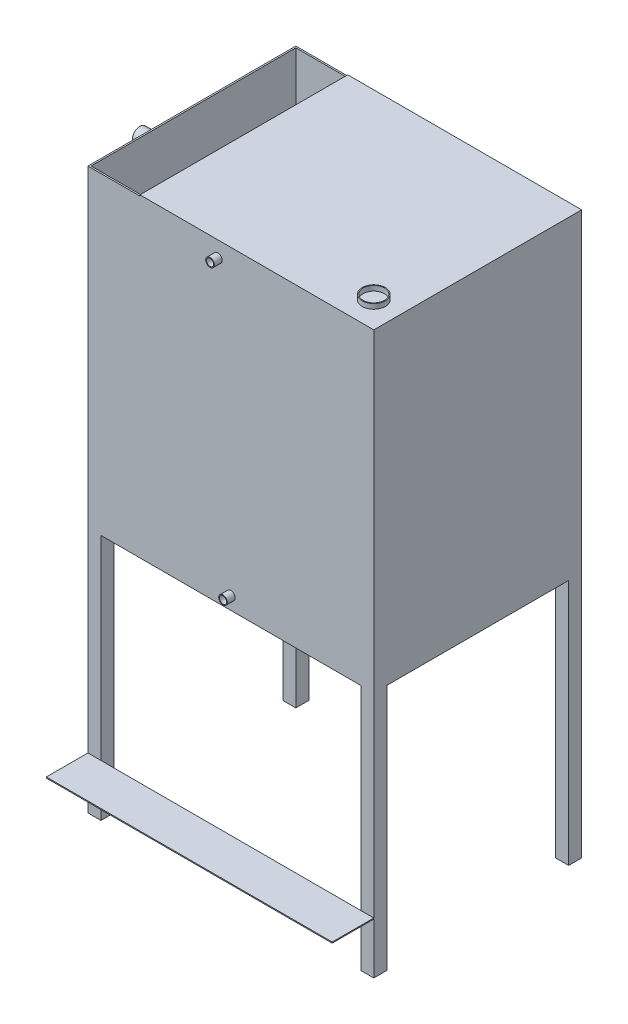
from build123d import *

# Parameters (mm, degrees)
SKETCH_1_W           = 1100
SKETCH_1_H           = 800
EXTRUDE_1_DEPTH      = 6
SKETCH_3_W           = 1100
SKETCH_3_H           = 800
SKETCH_3_W_2         = 1088
SKETCH_3_H_2         = 788
EXTRUDE_2_DEPTH      = 1200
SKETCH_4_W           = 900
SKETCH_4_H           = 800
EXTRUDE_3_DEPTH      = 4
SKETCH_5_W           = 50
SKETCH_5_H           = 50
EXTRUDE_4_DEPTH      = 950
EXTRUDE_5_DEPTH      = 19
EXTRUDE_5_DEPTH_BACK = 800
SKETCH_6_R           = 44.5
SKETCH_6_R_2         = 41
SKETCH_7_R           = 28.5
SKETCH_7_R_2         = 25
EXTRUDE_6_DEPTH      = 50
EXTRUDE_7_DEPTH      = 50
EXTRUDE_7_DEPTH_BACK = 50
SKETCH_8_R           = 16.75
SKETCH_8_R_2         = 13.55
SKETCH_9_R           = 21.15
SKETCH_9_R_2         = 17.95
EXTRUDE_8_DEPTH      = 49
SKETCH_10_R          = 16.75
SKETCH_10_R_2        = 13.55
EXTRUDE_9_DEPTH      = 30
SKETCH_13_W          = 1100
SKETCH_13_H          = 4
EXTRUDE_12_DEPTH     = 160
SKETCH_14_R          = 16.75
SKETCH_14_R_2        = 13.55
EXTRUDE_13_DEPTH     = 30


with BuildPart() as part:
    # Эскиз1 → Бобышка-Вытянуть1 (new body)
    with BuildSketch(Plane(origin=(0, 0, 0), x_dir=(1, 0, 0), z_dir=(0, 1, 0))):
        with Locations((550, 400)):
            Rectangle(SKETCH_1_W, SKETCH_1_H)
    extrude(amount=EXTRUDE_1_DEPTH)

    # Эскиз3 → Бобышка-Вытянуть2 (add)
    with BuildSketch(Plane(origin=(0, 6, 0), x_dir=(1, 0, 0), z_dir=(0, 1, 0))):
        with Locations((550, 400)):
            Rectangle(SKETCH_3_W, SKETCH_3_H)
        with Locations((550, 400)):
            Rectangle(SKETCH_3_W_2, SKETCH_3_H_2, mode=Mode.SUBTRACT)
    extrude(amount=EXTRUDE_2_DEPTH)

    # Эскиз4 → Бобышка-Вытянуть3 (add)
    with BuildSketch(Plane(origin=(0, 1206, 0), x_dir=(1, 0, 0), z_dir=(0, 1, 0))):
        with Locations((650, 400)):
            Rectangle(SKETCH_4_W, SKETCH_4_H)
    extrude(amount=EXTRUDE_3_DEPTH)

    # Эскиз5 → Бобышка-Вытянуть4 (add)
    with BuildSketch(Plane.XZ):
        with Locations((1075, -25)):
            Rectangle(SKETCH_5_W, SKETCH_5_H)
        with Locations((25, -25)):
            Rectangle(SKETCH_5_W, SKETCH_5_H)
        with Locations((1075, -775)):
            Rectangle(SKETCH_5_W, SKETCH_5_H)
        with Locations((25, -775)):
            Rectangle(SKETCH_5_W, SKETCH_5_H)
    extrude(amount=EXTRUDE_4_DEPTH)

    # Эскиз6 → Бобышка-Вытянуть5 (add, two sides: drawn at the far end of the back side and taken through both)
    with BuildSketch(Plane(origin=(0, 1210, 0), x_dir=(1, 0, 0), z_dir=(0, 1, 0)).offset(-EXTRUDE_5_DEPTH_BACK)):
        with Locations(Location((1000, 100, 0), (0, 0, 270))):
            Circle(SKETCH_6_R)
        with Locations(Location((1000, 100, 0), (0, 0, 270))):
            Circle(SKETCH_6_R_2, mode=Mode.SUBTRACT)
    extrude(amount=EXTRUDE_5_DEPTH + EXTRUDE_5_DEPTH_BACK)

    # Эскиз7 → Бобышка-Вытянуть6 (add)
    with BuildSketch(Plane.ZY):
        with Locations(Location((-250, 1160, 0), (0, 0, 180))):
            Circle(SKETCH_7_R)
        with Locations((-250, 1160)):
            Circle(SKETCH_7_R_2, mode=Mode.SUBTRACT)
    extrude(amount=EXTRUDE_6_DEPTH)

    # Эскиз8 → Бобышка-Вытянуть7 (add, two sides: drawn at the far end of the back side and taken through both)
    with BuildSketch(Plane.XZ.offset(-EXTRUDE_7_DEPTH_BACK)):
        with Locations(Location((171.2, -100, 0), (0, 0, 270))):
            Circle(SKETCH_8_R)
        with Locations(Location((171.2, -100, 0), (0, 0, 270))):
            Circle(SKETCH_8_R_2, mode=Mode.SUBTRACT)
    extrude(amount=EXTRUDE_7_DEPTH + EXTRUDE_7_DEPTH_BACK)

    # Эскиз9 → Бобышка-Вытянуть8 (add)
    with BuildSketch(Plane.XZ):
        with Locations(Location((300, -250, 0), (0, 0, 270))):
            Circle(SKETCH_9_R)
        with Locations(Location((300, -250, 0), (0, 0, 270))):
            Circle(SKETCH_9_R_2, mode=Mode.SUBTRACT)
    extrude(amount=EXTRUDE_8_DEPTH)

    # Эскиз10 → Бобышка-Вытянуть9 (add)
    with BuildSketch(Plane.XY):
        with Locations(Location((500, 1150, 0), (0, 0, 180))):
            Circle(SKETCH_10_R)
        with Locations((500, 1150)):
            Circle(SKETCH_10_R_2, mode=Mode.SUBTRACT)
    extrude(amount=EXTRUDE_9_DEPTH)

    # Эскиз13 → Бобышка-Вытянуть12 (add)
    with BuildSketch(Plane.XY):
        with Locations((550, -752)):
            Rectangle(SKETCH_13_W, SKETCH_13_H)
    extrude(amount=EXTRUDE_12_DEPTH)

    # Эскиз14 → Бобышка-Вытянуть13 (add)
    with BuildSketch(Plane.XY):
        with Locations(Location((550, 50, 0), (0, 0, 180))):
            Circle(SKETCH_14_R)
        with Locations((550, 50)):
            Circle(SKETCH_14_R_2, mode=Mode.SUBTRACT)
    extrude(amount=EXTRUDE_13_DEPTH)


solid = part.part
